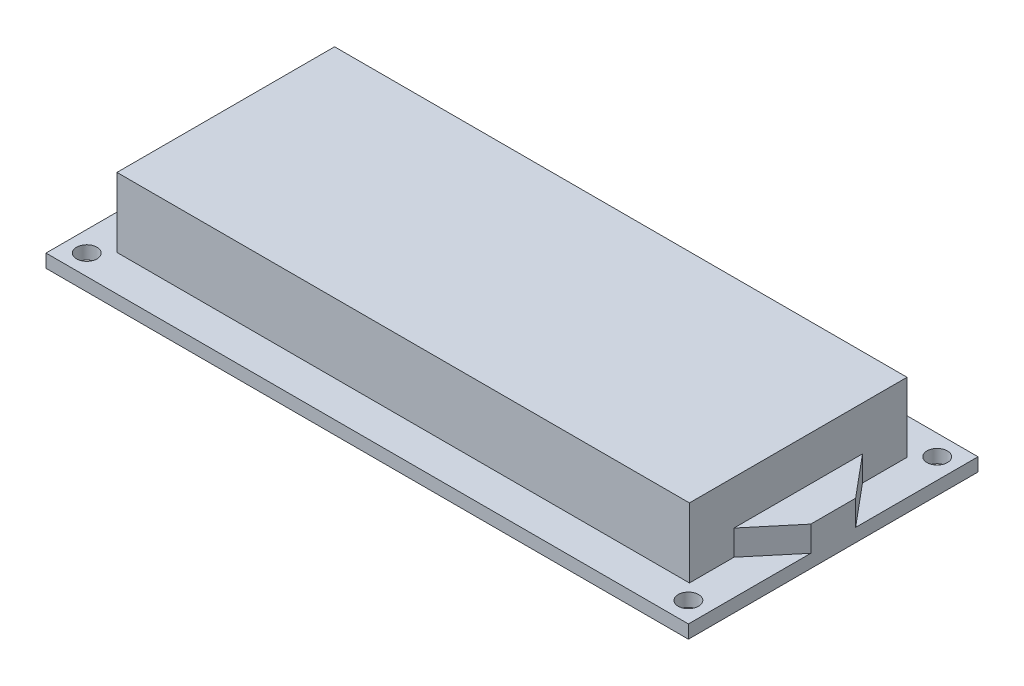
from build123d import *

# Parameters (mm, degrees)
SKETCH1_W           = 80.01
SKETCH1_H           = 36.068
BOSS_EXTRUDE1_DEPTH = 1.651
SKETCH2_R           = 1.27
CUT_EXTRUDE1_DEPTH  = 2.54
SKETCH3_W           = 71.2978
SKETCH3_H           = 27.1018
BOSS_EXTRUDE2_DEPTH = 8.636
BOSS_EXTRUDE3_DEPTH = 3.1496
SKETCH5_W           = 3.175
SKETCH5_H           = 3.175
BOSS_EXTRUDE4_DEPTH = 2.38125


with BuildPart() as part:
    # Sketch1 → Boss-Extrude1 (new body)
    with BuildSketch(Plane(origin=(0, 0, 0), x_dir=(1, 0, 0), z_dir=(0, 1, 0))):
        with Locations((40.005, 32.202836909)):
            Rectangle(SKETCH1_W, SKETCH1_H)
    extrude(amount=BOSS_EXTRUDE1_DEPTH)

    # Sketch2 → Cut-Extrude1 (cut)
    with BuildSketch(Plane(origin=(0, 1.651, 0), x_dir=(1, 0, 0), z_dir=(0, 1, 0))):
        with Locations(Location((2.54, 47.696836909, 0), (0, 0, 270))):
            Circle(SKETCH2_R)
        with Locations(Location((2.54, 16.708836909, 0), (0, 0, 270))):
            Circle(SKETCH2_R)
        with Locations(Location((77.47, 47.696836909, 0), (0, 0, 270))):
            Circle(SKETCH2_R)
        with Locations(Location((77.47, 16.708836909, 0), (0, 0, 270))):
            Circle(SKETCH2_R)
    extrude(amount=-CUT_EXTRUDE1_DEPTH, mode=Mode.SUBTRACT)

    # Sketch3 → Boss-Extrude2 (add)
    with BuildSketch(Plane(origin=(0, 1.651, 0), x_dir=(1, 0, 0), z_dir=(0, 1, 0))):
        with Locations((40.005, 32.202836909)):
            Rectangle(SKETCH3_W, SKETCH3_H)
    extrude(amount=BOSS_EXTRUDE2_DEPTH)

    # Sketch4 → Boss-Extrude3 (add)
    with BuildSketch(Plane(origin=(0, 1.651, 0), x_dir=(1, 0, 0), z_dir=(0, 1, 0))):
        Polygon((4.3561, 40.203836909), (0, 34.996836909), (0, 29.408836909), (4.3561, 24.201836909), align=None)
    boss_extrude3 = extrude(amount=BOSS_EXTRUDE3_DEPTH)

    # Mirror1: Boss-Extrude3 across plane
    add(boss_extrude3.mirror(Plane.ZY.offset(-40.005)))

    # Sketch5 → Boss-Extrude4 (add)
    with BuildSketch(Plane.XZ):
        with Locations((42.8625, -20.518836909)):
            Rectangle(SKETCH5_W, SKETCH5_H)
    extrude(amount=BOSS_EXTRUDE4_DEPTH)


solid = part.part
